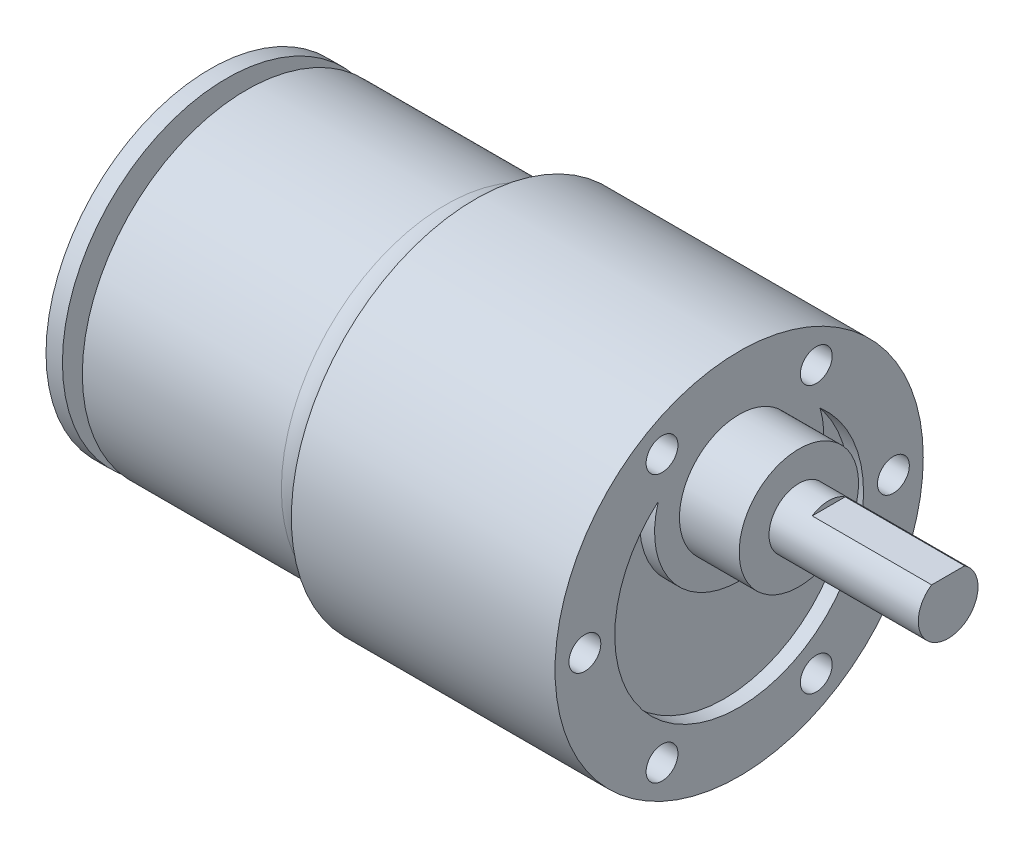
from build123d import *

# Parameters (mm, degrees)
CROQUIS_MOTOR_BASE_R      = 16.5
SALIENTE_EXTRUIR1_DEPTH   = 23
REDONDEO1_R               = 3
CROQUIS_REDUCTOR_BASE_R   = 18.5
SALIENTE_EXTRUIR2_DEPTH   = 26.5
CROQUIS_MOTOR_SHAFT_R     = 6
SALIENTE_EXTRUIR3_DEPTH   = 6
CORTAR_EXTRUIR1_DEPTH     = 1.5
CROQUIS_SHAFT_R           = 3
SALIENTE_EXTRUIR4_DEPTH   = 15
CORTAR_EXTRUIR2_START     = -12
CORTAR_EXTRUIR2_DEPTH     = 12
CROQUIS_MOUNT_AND_CLOSE_R = 1.6
CORTAR_EXTRUIR3_DEPTH     = 3
CROQUIS_MOTOR_SHAFT_OUT_R = 4
SALIENTE_EXTRUIR5_DEPTH   = 2
SALIENTE_EXTRUIR6_START   = 1.65
CROQUIS_ELECTRONICS_R     = 16.5
SALIENTE_EXTRUIR6_DEPTH   = 1.65
CROQUIS_MOTOR_AXIS_R      = 1
SALIENTE_EXTRUIR7_DEPTH   = 1.65
CROQUIS_ENCODER_R         = 7
SALIENTE_EXTRUIR8_DEPTH   = 5


with BuildPart() as part:
    # Croquis motor base → Saliente-Extruir1 (new body)
    with BuildSketch(Plane(origin=(0, 0, 0), x_dir=(0, 0, -1), z_dir=(1, 0, 0))):
        Circle(CROQUIS_MOTOR_BASE_R)
    extrude(amount=SALIENTE_EXTRUIR1_DEPTH)

    # Redondeo1
    redondeo1_edges = [part.edges().sort_by_distance(p)[0] for p in [
        (23, 0, 16.5),
    ]]
    fillet(redondeo1_edges, radius=REDONDEO1_R)

    # Croquis reductor base → Saliente-Extruir2 (add)
    with BuildSketch(Plane(origin=(23, 0, 0), x_dir=(0, 0, -1), z_dir=(1, 0, 0))):
        Circle(CROQUIS_REDUCTOR_BASE_R)
    extrude(amount=SALIENTE_EXTRUIR2_DEPTH)

    # Croquis motor shaft → Saliente-Extruir3 (add)
    with BuildSketch(Plane(origin=(49.5, 0, 0), x_dir=(0, 0, -1), z_dir=(1, 0, 0))):
        with Locations((0, 7)):
            Circle(CROQUIS_MOTOR_SHAFT_R)
    extrude(amount=SALIENTE_EXTRUIR3_DEPTH)

    # Croquis motor shaft<3> → Cortar-Extruir1 (cut)
    with BuildSketch(Plane(origin=(49.5, 0, 0), x_dir=(0, 0, -1), z_dir=(1, 0, 0))):
        with BuildLine():
            ThreePointArc((8.124038405, 9.5), (8.405484116, 8.264055687), (8.5, 7))
            ThreePointArc((8.5, 7), (-1.264055687, -1.405484116), (-8.124038405, 9.5))
            ThreePointArc((-8.124038405, 9.5), (0, -12.5), (8.124038405, 9.5))
        make_face()
    extrude(amount=-CORTAR_EXTRUIR1_DEPTH, mode=Mode.SUBTRACT)

    # Croquis shaft → Saliente-Extruir4 (add)
    with BuildSketch(Plane(origin=(55.5, 0, 0), x_dir=(0, 0, -1), z_dir=(1, 0, 0))):
        with Locations((0, 7)):
            Circle(CROQUIS_SHAFT_R)
    extrude(amount=SALIENTE_EXTRUIR4_DEPTH)

    # Croquis shaft lock → Cortar-Extruir2 (cut)
    with BuildSketch(Plane(origin=(70.5, 0, 0), x_dir=(0, 0, -1), z_dir=(1, 0, 0)).offset(CORTAR_EXTRUIR2_START)):
        with BuildLine():
            Line((-1.658312395, 9.5), (1.658312395, 9.5))
            ThreePointArc((1.658312395, 9.5), (0, 10), (-1.658312395, 9.5))
        make_face()
    extrude(amount=CORTAR_EXTRUIR2_DEPTH, mode=Mode.SUBTRACT)

    # Croquis mount and close → Cortar-Extruir3 (cut)
    with BuildSketch(Plane(origin=(49.5, 0, 0), x_dir=(0, 0, -1), z_dir=(1, 0, 0))):
        with Locations((-15.5, 0)):
            Circle(CROQUIS_MOUNT_AND_CLOSE_R)
        with Locations((-7.75, 13.423393759)):
            Circle(CROQUIS_MOUNT_AND_CLOSE_R)
        with Locations((7.75, 13.423393759)):
            Circle(CROQUIS_MOUNT_AND_CLOSE_R)
        with Locations((15.5, 0)):
            Circle(CROQUIS_MOUNT_AND_CLOSE_R)
        with Locations((7.75, -13.423393759)):
            Circle(CROQUIS_MOUNT_AND_CLOSE_R)
        with Locations((-7.75, -13.423393759)):
            Circle(CROQUIS_MOUNT_AND_CLOSE_R)
    extrude(amount=-CORTAR_EXTRUIR3_DEPTH, mode=Mode.SUBTRACT)

    # Croquis motor shaft out → Saliente-Extruir5 (add)
    with BuildSketch(Plane.ZY):
        Circle(CROQUIS_MOTOR_SHAFT_OUT_R)
    extrude(amount=SALIENTE_EXTRUIR5_DEPTH)

    # Croquis electronics → Saliente-Extruir6 (add)
    with BuildSketch(Plane.ZY.offset(2).offset(SALIENTE_EXTRUIR6_START)):
        Circle(CROQUIS_ELECTRONICS_R)
    extrude(amount=-SALIENTE_EXTRUIR6_DEPTH)

    # Croquis motor axis → Saliente-Extruir7 (add)
    with BuildSketch(Plane.ZY.offset(3.65)):
        Circle(CROQUIS_MOTOR_AXIS_R)
    extrude(amount=SALIENTE_EXTRUIR7_DEPTH)

    # Croquis encoder → Saliente-Extruir8 (add)
    with BuildSketch(Plane.ZY.offset(5.3)):
        Circle(CROQUIS_ENCODER_R)
    extrude(amount=SALIENTE_EXTRUIR8_DEPTH)


solid = part.part
